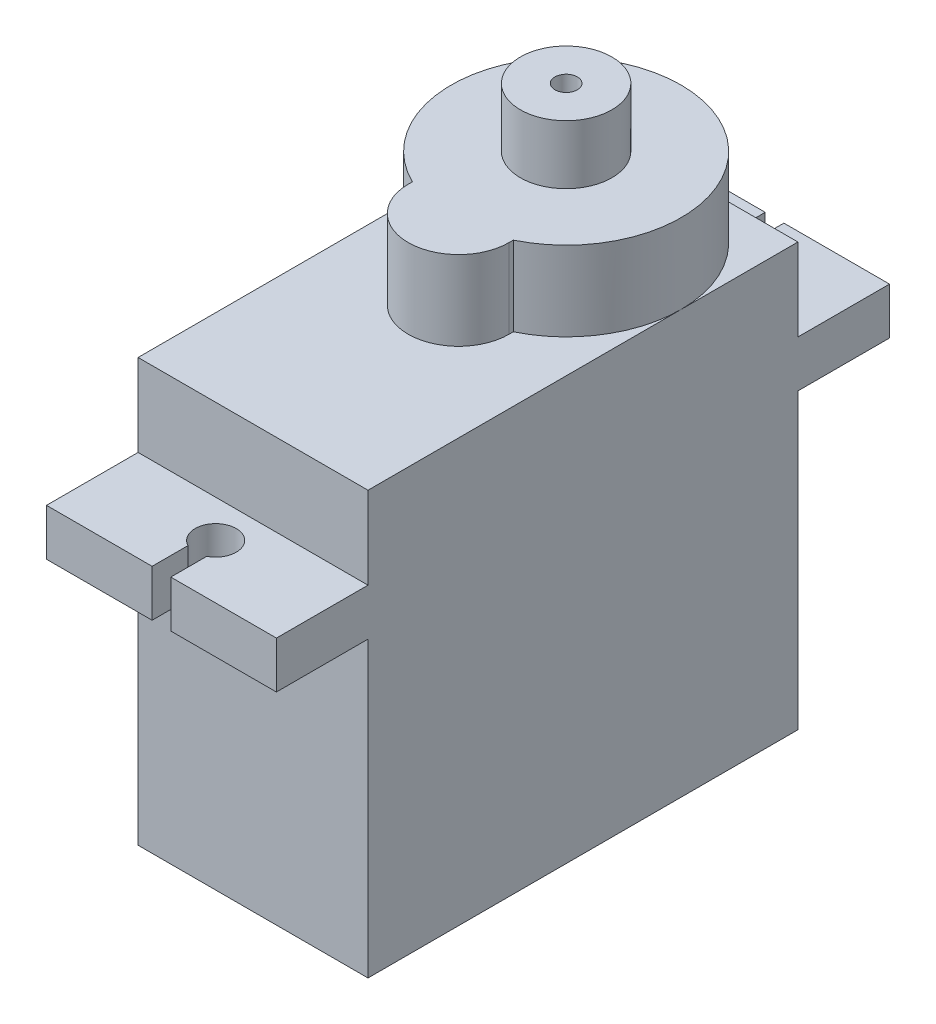
from build123d import *

# Parameters (mm, degrees)
IZIM1_W                     = 12.3
IZIM1_H                     = 23
Y_KSEKLIK_EKSTR_ZYON1_DEPTH = 22.6
Y_KSEKLIK_EKSTR_ZYON2_DEPTH = 2.5
IZIM3_W                     = 3.6
IZIM3_H                     = 3
Y_KSEKLIK_EKSTR_ZYON3_DEPTH = 1.2
IZIM4_R                     = 6.15
Y_KSEKLIK_EKSTR_ZYON4_DEPTH = 4.25
IZIM5_R                     = 2.45
IZIM5_R_2                   = 0.6
Y_KSEKLIK_EKSTR_ZYON6_DEPTH = 3.15
IZIM6_W                     = 0.1
IZIM6_H                     = 1.2
KES_EKSTR_ZYON1_DEPTH       = 3
RADYUS1_R                   = 0.5


with BuildPart() as part:
    # Çizim1 → Yükseklik-Ekstrüzyon1 (new body)
    with BuildSketch(Plane(origin=(0, 0, 0), x_dir=(1, 0, 0), z_dir=(0, 1, 0))):
        Rectangle(IZIM1_W, IZIM1_H)
    extrude(amount=Y_KSEKLIK_EKSTR_ZYON1_DEPTH)

    # Çizim2 → Yükseklik-Ekstrüzyon2 (add)
    with BuildSketch(Plane(origin=(0, 18.2, 0), x_dir=(1, 0, 0), z_dir=(0, 1, 0))):
        with BuildLine():
            Line((-6.15, 16.4), (-6.15, -16.4))
            Line((-6.15, -16.4), (-0.5, -16.4))
            Line((-0.5, -16.4), (-0.5, -14.479795897))
            ThreePointArc((-0.5, -14.479795897), (-0.574456265, -12.561916848), (1.1, -13.5))
            ThreePointArc((1.1, -13.5), (0.938083152, -14.074456265), (0.5, -14.479795897))
            Line((0.5, -14.479795897), (0.5, -16.4))
            Line((0.5, -16.4), (6.15, -16.4))
            Line((6.15, -16.4), (6.15, 16.4))
            Line((6.15, 16.4), (0.5, 16.4))
            Line((0.5, 16.4), (0.5, 14.479795897))
            ThreePointArc((0.5, 14.479795897), (0.938083152, 14.074456265), (1.1, 13.5))
            ThreePointArc((1.1, 13.5), (-0.574456265, 12.561916848), (-0.5, 14.479795897))
            Line((-0.5, 14.479795897), (-0.5, 16.4))
            Line((-0.5, 16.4), (-6.15, 16.4))
        make_face()
    extrude(amount=-Y_KSEKLIK_EKSTR_ZYON2_DEPTH)

    # Çizim3 → Yükseklik-Ekstrüzyon3 (add)
    with BuildSketch(Plane(origin=(0, 4.8, 0), x_dir=(-1, 0, 0), z_dir=(0, -1, 0))):
        with Locations((0, 13)):
            Rectangle(IZIM3_W, IZIM3_H)
    extrude(amount=Y_KSEKLIK_EKSTR_ZYON3_DEPTH)

    # Çizim4 → Yükseklik-Ekstrüzyon4 (add)
    with BuildSketch(Plane(origin=(0, 22.6, 0), x_dir=(1, 0, 0), z_dir=(0, 1, 0))):
        with Locations((0, 5.25)):
            Circle(IZIM4_R)
        with BuildLine():
            Line((-2.7, -0.275622137), (-2.7, -0.5))
            ThreePointArc((-2.7, -0.5), (0, -3.2), (2.7, -0.5))
            Line((2.7, -0.5), (2.7, -0.275622137))
            ThreePointArc((2.7, -0.275622137), (0, -0.9), (-2.7, -0.275622137))
        make_face()
    extrude(amount=Y_KSEKLIK_EKSTR_ZYON4_DEPTH)

    # Çizim5 → Yükseklik-Ekstrüzyon6 (add)
    with BuildSketch(Plane(origin=(0, 26.85, 0), x_dir=(1, 0, 0), z_dir=(0, 1, 0))):
        with Locations(Location((0, 5.25, 0), (0, 0, 90))):
            Circle(IZIM5_R)
        with Locations(Location((0, 5.25, 0), (0, 0, 270))):
            Circle(IZIM5_R_2, mode=Mode.SUBTRACT)
    extrude(amount=Y_KSEKLIK_EKSTR_ZYON6_DEPTH)

    # Çizim6 → Kes-Ekstrüzyon1 (cut)
    with BuildSketch(Plane(origin=(0, 0, -14.5), x_dir=(-1, 0, 0), z_dir=(0, 0, -1))):
        with Locations((-0.616666667, 4.2)):
            Rectangle(IZIM6_W, IZIM6_H)
        with Locations((0.616666667, 4.2)):
            Rectangle(IZIM6_W, IZIM6_H)
    extrude(amount=-KES_EKSTR_ZYON1_DEPTH, mode=Mode.SUBTRACT)

    # Radyus1
    radyus1_edges = [part.edges().sort_by_distance(p)[0] for p in [
        (0.566666667, 3.6, -13),
        (0.566666667, 4.8, -13),
        (0.666666667, 4.8, -13),
        (0.666666667, 3.6, -13),
        (-0.666666667, 3.6, -13),
        (-0.666666667, 4.8, -13),
        (-0.566666667, 4.8, -13),
        (-0.566666667, 3.6, -13),
        (1.8, 4.8, -13),
        (-1.8, 4.8, -13),
        (1.8, 3.6, -13),
        (-1.8, 3.6, -13),
    ]]
    fillet(radyus1_edges, radius=RADYUS1_R)


solid = part.part
